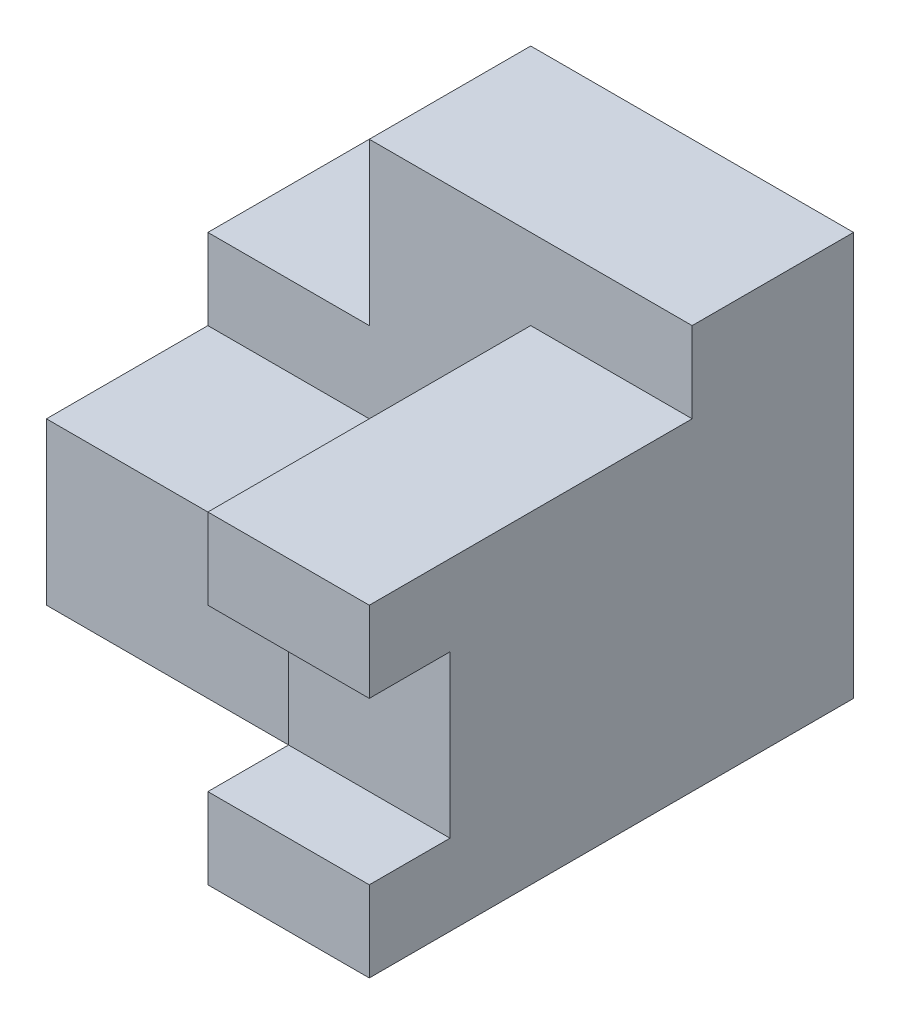
from build123d import *

# Parameters (mm, degrees)
SKETCH1_W            = 80
SKETCH1_H            = 40
BOSS_EXTRUDE1_DEPTH  = 120
BOSS_EXTRUDE2_DEPTH  = 40
BOSS_EXTRUDE3_DEPTH  = 80
SKETCH1_5_W          = 80
SKETCH1_5_H          = 40
BOSS_EXTRUDE4_DEPTH  = 120
SKETCH1_6_W          = 80
SKETCH1_6_H          = 40
BOSS_EXTRUDE5_DEPTH  = 120
BOSS_EXTRUDE6_DEPTH  = 120
SKETCH1_8_W          = 80
SKETCH1_8_H          = 40
BOSS_EXTRUDE7_DEPTH  = 120
BOSS_EXTRUDE8_DEPTH  = 120
SKETCH2_W            = 80
SKETCH2_H            = 80
BOSS_EXTRUDE9_DEPTH  = 40
SKETCH3_W            = 80
SKETCH3_H            = 120
BOSS_EXTRUDE10_DEPTH = 80
SKETCH4_W            = 80
SKETCH4_H            = 40
BOSS_EXTRUDE11_DEPTH = 80


with BuildPart() as part:
    # Sketch1 → Boss-Extrude1 (new body)
    with BuildSketch(Plane.XY):
        with Locations((80, -80)):
            Rectangle(SKETCH1_W, SKETCH1_H)
    extrude(amount=BOSS_EXTRUDE1_DEPTH)

    # Sketch1<3> → Boss-Extrude2 (add)
    with BuildSketch(Plane.XY):
        Polygon((40, -100), (40, -60), (40, -20), (-120, -20), (-120, -100), align=None)
    extrude(amount=BOSS_EXTRUDE2_DEPTH)

    # Sketch1<4> → Boss-Extrude3 (add)
    with BuildSketch(Plane.XY):
        Polygon((40, -60), (120, -60), (120, 20), (40, 20), (40, -20), align=None)
    extrude(amount=BOSS_EXTRUDE3_DEPTH)

    # Sketch1<5> → Boss-Extrude4 (add)
    with BuildSketch(Plane.XY):
        with Locations((80, 40)):
            Rectangle(SKETCH1_5_W, SKETCH1_5_H)
    extrude(amount=BOSS_EXTRUDE4_DEPTH)

    # Sketch1<6> → Boss-Extrude5 (add)
    with BuildSketch(Plane.XY):
        with Locations((80, 40)):
            Rectangle(SKETCH1_6_W, SKETCH1_6_H)
    extrude(amount=-BOSS_EXTRUDE5_DEPTH)

    # Sketch1<7> → Boss-Extrude6 (add)
    with BuildSketch(Plane.XY):
        Polygon((40, -60), (120, -60), (120, 20), (40, 20), (40, -20), align=None)
    extrude(amount=-BOSS_EXTRUDE6_DEPTH)

    # Sketch1<8> → Boss-Extrude7 (add)
    with BuildSketch(Plane.XY):
        with Locations((80, -80)):
            Rectangle(SKETCH1_8_W, SKETCH1_8_H)
    extrude(amount=-BOSS_EXTRUDE7_DEPTH)

    # Sketch1<9> → Boss-Extrude8 (add)
    with BuildSketch(Plane.XY):
        Polygon((40, -100), (40, -60), (40, -20), (-120, -20), (-120, -100), align=None)
    extrude(amount=-BOSS_EXTRUDE8_DEPTH)

    # Sketch2 → Boss-Extrude9 (add)
    with BuildSketch(Plane(origin=(0, 60, 0), x_dir=(1, 0, 0), z_dir=(0, 1, 0))):
        with Locations((80, 80)):
            Rectangle(SKETCH2_W, SKETCH2_H)
    extrude(amount=BOSS_EXTRUDE9_DEPTH)

    # Sketch3 → Boss-Extrude10 (add)
    with BuildSketch(Plane.ZY.offset(-40)):
        with Locations((-80, 40)):
            Rectangle(SKETCH3_W, SKETCH3_H)
    extrude(amount=BOSS_EXTRUDE10_DEPTH)

    # Sketch4 → Boss-Extrude11 (add)
    with BuildSketch(Plane.ZY.offset(40)):
        with Locations((-80, 0)):
            Rectangle(SKETCH4_W, SKETCH4_H)
    extrude(amount=BOSS_EXTRUDE11_DEPTH)


solid = part.part
